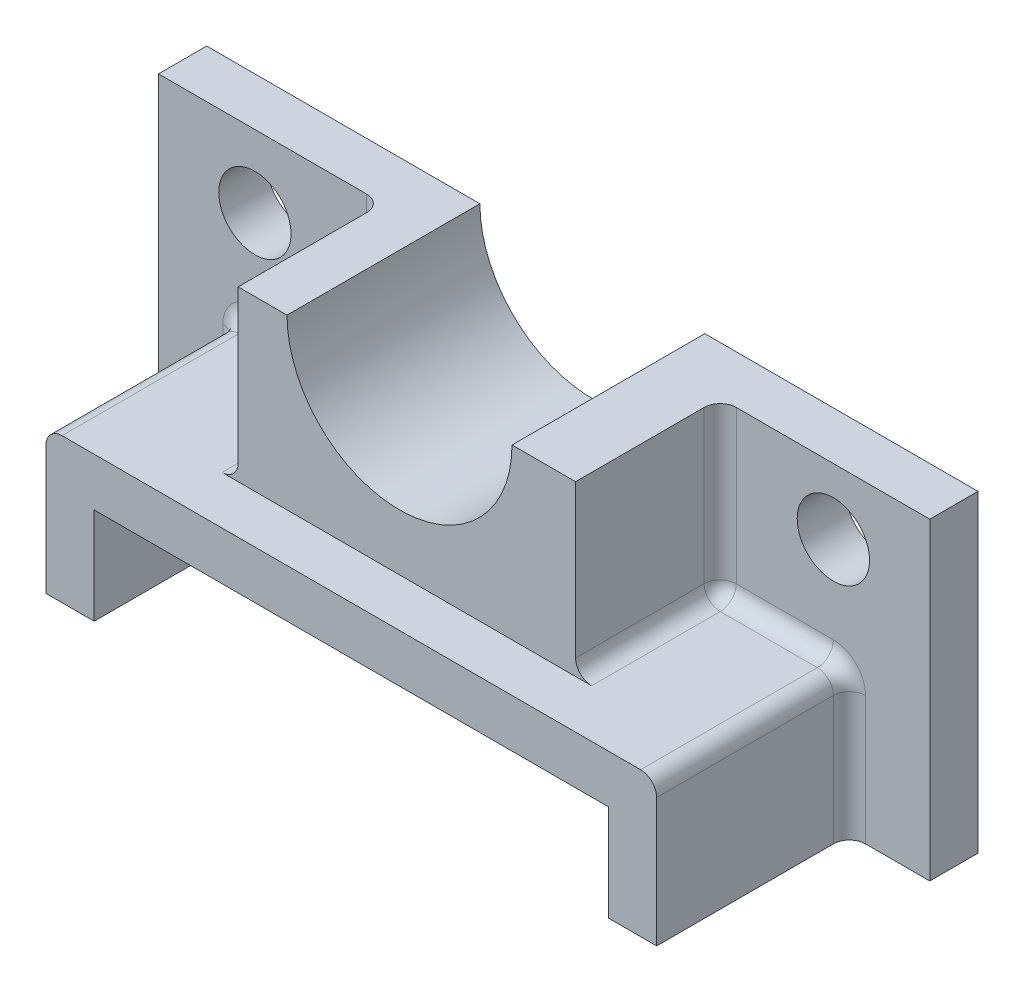
from build123d import *

# Parameters (mm, degrees)
SKETCH1_R             = 7.14375
BOSS_EXTRUDE1_DEPTH   = 9.525
BOSS_EXTRUDE1_2_DEPTH = 9.525
BOSS_EXTRUDE2_DEPTH   = 47.625
BOSS_EXTRUDE3_DEPTH   = 38.1
FILLET1_R             = 3.175


with BuildPart() as part:
    # Sketch1 → Boss-Extrude1 (new body)
    with BuildSketch(Plane.XY):
        Polygon((-26.883211679, -10.996624088), (-26.883211679, 22.340875912), (-71.194160584, 22.340875912), (-71.194160584, -39.571624088), (-55.319160584, -39.571624088), (-55.319160584, -10.996624088), align=None)
        with Locations((-52.144160584, 8.053375912)):
            Circle(SKETCH1_R, mode=Mode.SUBTRACT)
    extrude(amount=BOSS_EXTRUDE1_DEPTH)



with BuildPart() as body_2:
    # Sketch1 → Boss-Extrude1 2 (new body)
    with BuildSketch(Plane.XY):
        Polygon((39.791788321, 22.340875912), (39.791788321, -10.996624088), (65.330839416, -10.996624088), (65.330839416, -39.571624088), (81.205839416, -39.571624088), (81.205839416, 22.340875912), align=None)
        with Locations((62.155839416, 9.351186131)):
            Circle(SKETCH1_R, mode=Mode.SUBTRACT)
    extrude(amount=BOSS_EXTRUDE1_2_DEPTH)


with BuildPart() as part_1:
    add(part.part)

    add(body_2.part)  # Boss-Extrude2 merges body 2
    # Sketch1<4> → Boss-Extrude2 (add)
    with BuildSketch(Plane.XY):
        Polygon((39.791788321, -10.996624088), (-26.883211679, -10.996624088), (-55.319160584, -10.996624088), (-55.319160584, -39.571624088), (-45.794160584, -39.571624088), (-45.794160584, -37.984124088), (-45.794160584, -20.521624088), (55.805839416, -20.521624088), (55.805839416, -37.984124088), (55.805839416, -39.571624088), (65.330839416, -39.571624088), (65.330839416, -10.996624088), align=None)
    extrude(amount=BOSS_EXTRUDE2_DEPTH)

    # Sketch1<5> → Boss-Extrude3 (add)
    with BuildSketch(Plane.XY):
        with BuildLine():
            Line((-17.219160584, 22.340875912), (-26.883211679, 22.340875912))
            Line((-26.883211679, 22.340875912), (-26.883211679, -10.996624088))
            Line((-26.883211679, -10.996624088), (39.791788321, -10.996624088))
            Line((39.791788321, -10.996624088), (39.791788321, 22.340875912))
            Line((39.791788321, 22.340875912), (27.230839416, 22.340875912))
            ThreePointArc((27.230839416, 22.340875912), (5.005839416, 0.115875912), (-17.219160584, 22.340875912))
        make_face()
    extrude(amount=BOSS_EXTRUDE3_DEPTH)

    # Fillet1
    fillet1_edges = [part_1.edges().sort_by_distance(p)[0] for p in [
        (-55.319160584, -10.996624088, 28.575),
        (-26.883211679, 5.672125912, 9.525),
        (-26.883211679, -10.996624088, 23.8125),
        (-55.319160584, -25.284124088, 9.525),
        (-41.101186131, -10.996624088, 9.525),
        (65.330839416, -25.284124088, 9.525),
        (52.561313869, -10.996624088, 9.525),
        (39.791788321, 5.672125912, 9.525),
        (39.791788321, -10.996624088, 23.8125),
        (65.330839416, -10.996624088, 28.575),
    ]]
    fillet(fillet1_edges, radius=FILLET1_R)


solid = part_1.part
